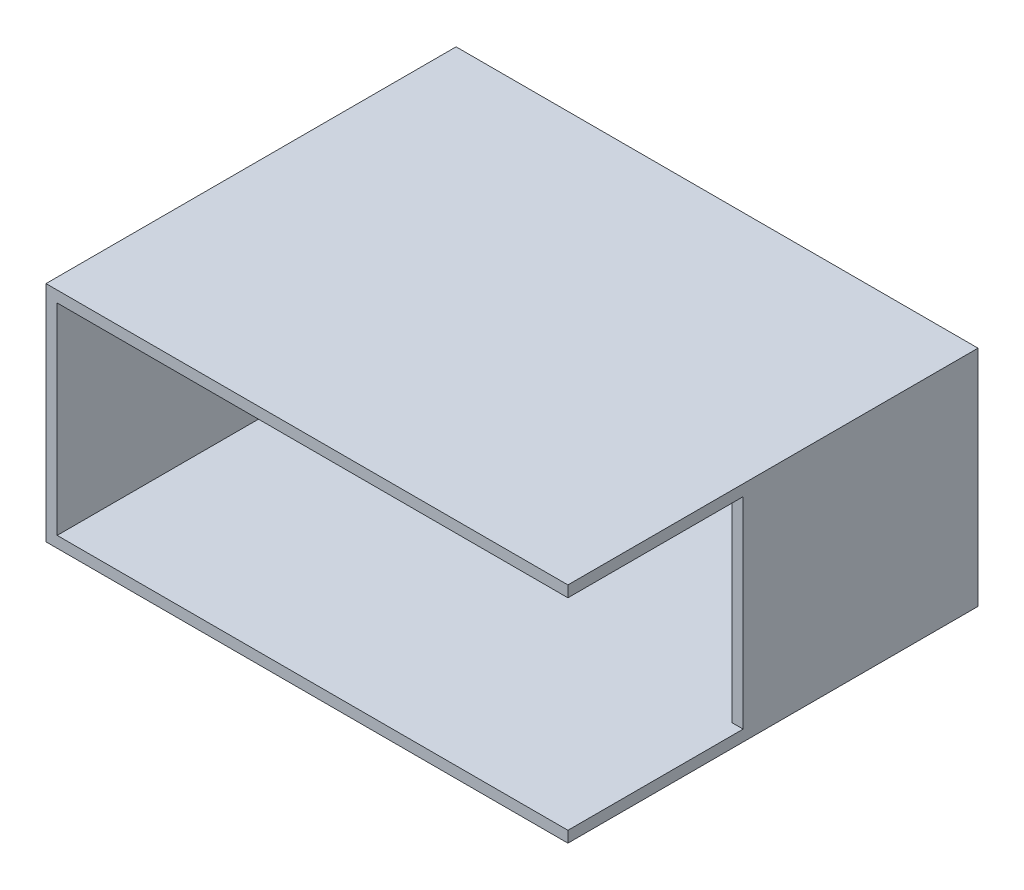
from build123d import *

# Parameters (mm, degrees)
SKETCH1_W           = 76.2
SKETCH1_H           = 139.7
BOSS_EXTRUDE1_DEPTH = 177.8
SKETCH2_W           = 68.58
SKETCH2_H           = 135.89
CUT_EXTRUDE1_DEPTH  = 173.99
SKETCH3_W           = 144.78
SKETCH3_H           = 17.78
CUT_EXTRUDE2_DEPTH  = 1.27
SKETCH5_W           = 3.81
SKETCH5_H           = 68.58
BOSS_EXTRUDE2_DEPTH = 76.2


with BuildPart() as part:
    # Sketch1 → Boss-Extrude1 (new body)
    with BuildSketch(Plane.YZ):
        with Locations((38.1, 69.85)):
            Rectangle(SKETCH1_W, SKETCH1_H)
    extrude(amount=BOSS_EXTRUDE1_DEPTH)

    # Sketch2 → Cut-Extrude1 (cut)
    with BuildSketch(Plane.YZ.offset(177.8)):
        with Locations((38.1, 71.755)):
            Rectangle(SKETCH2_W, SKETCH2_H)
    extrude(amount=-CUT_EXTRUDE1_DEPTH, mode=Mode.SUBTRACT)

    # Sketch3 → Cut-Extrude2 (cut)
    with BuildSketch(Plane.XY.offset(3.81)):
        with Locations((96.52, 38.1)):
            Rectangle(SKETCH3_W, SKETCH3_H)
    extrude(amount=-CUT_EXTRUDE2_DEPTH, mode=Mode.SUBTRACT)

    # Sketch5 → Boss-Extrude2 (add)
    with BuildSketch(Plane.XY.offset(3.81)):
        with Locations((175.895, 38.1)):
            Rectangle(SKETCH5_W, SKETCH5_H)
    extrude(amount=BOSS_EXTRUDE2_DEPTH)


solid = part.part
